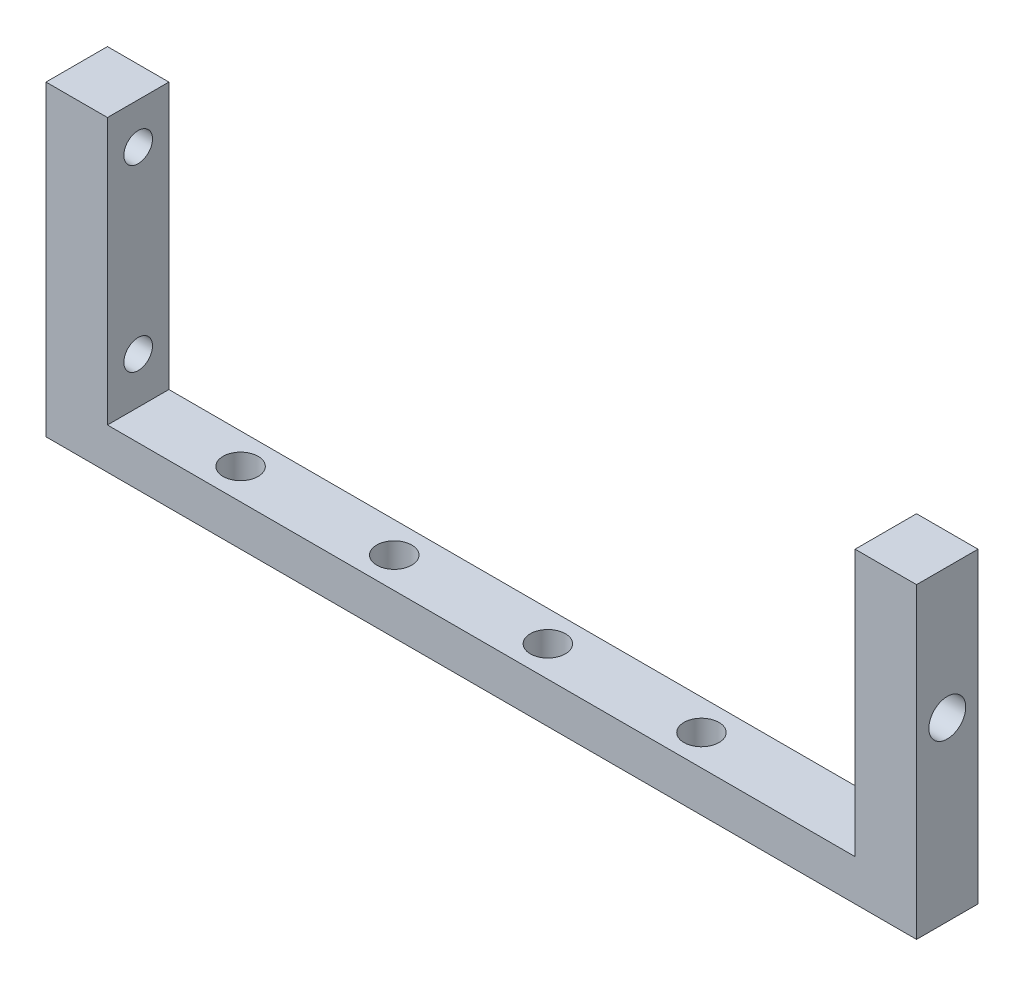
from build123d import *

# Parameters (mm, degrees)
SKETCH1_W           = 107.95
SKETCH1_H           = 7.62
BOSS_EXTRUDE1_DEPTH = 5.08
SKETCH2_W           = 7.62
SKETCH2_H           = 7.62
BOSS_EXTRUDE2_DEPTH = 33.02
SKETCH3_R           = 1.778
CUT_EXTRUDE1_DEPTH  = 7.62
SKETCH4_R           = 2.286
CUT_EXTRUDE2_DEPTH  = 7.62
SKETCH5_R           = 2.1717
CUT_EXTRUDE3_DEPTH  = 5.08


with BuildPart() as part:
    # Sketch1 → Boss-Extrude1 (new body)
    with BuildSketch(Plane(origin=(0, 0, 0), x_dir=(1, 0, 0), z_dir=(0, 1, 0))):
        with Locations((-53.975, -10.454877129)):
            Rectangle(SKETCH1_W, SKETCH1_H)
    extrude(amount=BOSS_EXTRUDE1_DEPTH)

    # Sketch2 → Boss-Extrude2 (add)
    with BuildSketch(Plane(origin=(0, 5.08, 0), x_dir=(1, 0, 0), z_dir=(0, 1, 0))):
        with Locations((-104.14, -10.454877129)):
            Rectangle(SKETCH2_W, SKETCH2_H)
        with Locations((-3.81, -10.454877129)):
            Rectangle(SKETCH2_W, SKETCH2_H)
    extrude(amount=BOSS_EXTRUDE2_DEPTH)

    # Sketch3 → Cut-Extrude1 (cut)
    with BuildSketch(Plane(origin=(-100.33, 0, 0), x_dir=(0, 0, -1), z_dir=(1, 0, 0))):
        with Locations((-10.454877129, 33.02)):
            Circle(SKETCH3_R)
        with Locations((-10.454877129, 10.795)):
            Circle(SKETCH3_R)
    extrude(amount=-CUT_EXTRUDE1_DEPTH, mode=Mode.SUBTRACT)

    # Sketch4 → Cut-Extrude2 (cut)
    with BuildSketch(Plane.ZY.offset(7.62)):
        with Locations((10.454877129, 21.9075)):
            Circle(SKETCH4_R)
    extrude(amount=-CUT_EXTRUDE2_DEPTH, mode=Mode.SUBTRACT)

    # Sketch5 → Cut-Extrude3 (cut)
    with BuildSketch(Plane(origin=(0, 5.08, 0), x_dir=(1, 0, 0), z_dir=(0, 1, 0))):
        with Locations(Location((-87.63, -10.454877129, 0), (0, 0, 270))):
            Circle(SKETCH5_R)
        with Locations(Location((-68.58, -10.454877129, 0), (0, 0, 270))):
            Circle(SKETCH5_R)
        with Locations(Location((-49.53, -10.454877129, 0), (0, 0, 270))):
            Circle(SKETCH5_R)
        with Locations(Location((-30.48, -10.454877129, 0), (0, 0, 270))):
            Circle(SKETCH5_R)
    extrude(amount=-CUT_EXTRUDE3_DEPTH, mode=Mode.SUBTRACT)


solid = part.part
